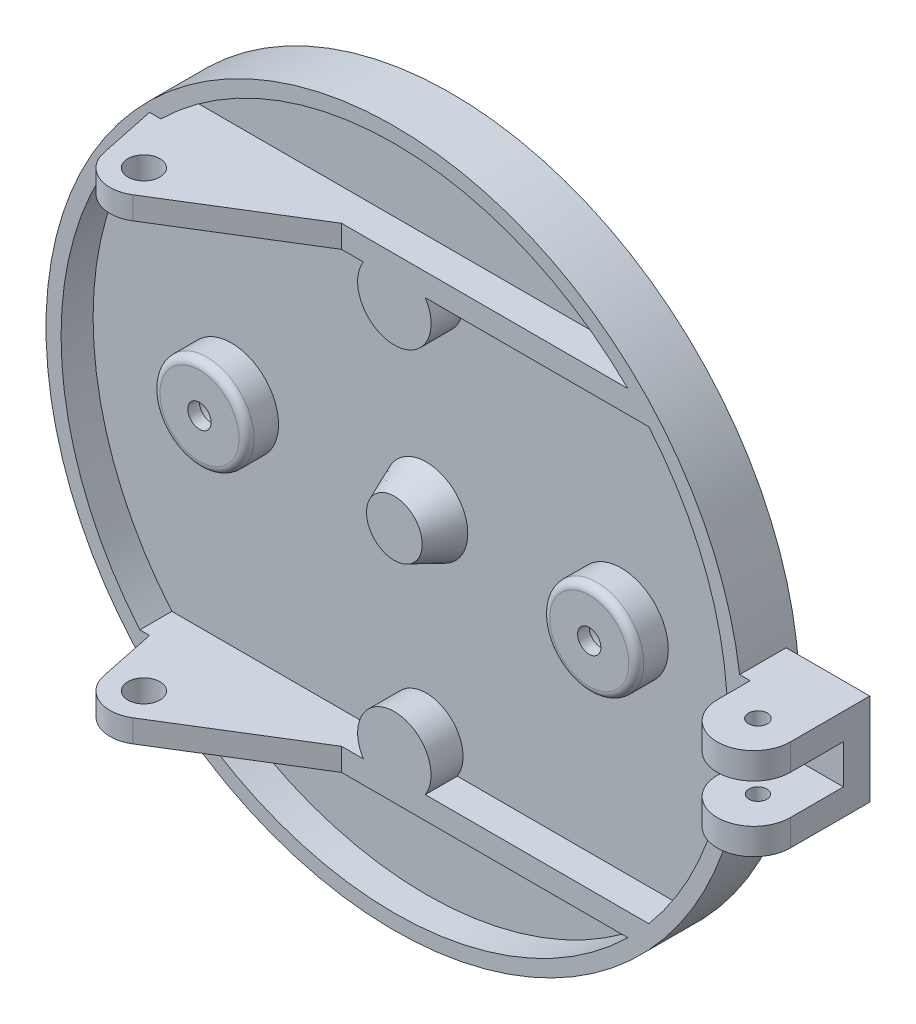
from build123d import *

# Parameters (mm, degrees)
ESQUISSE1_R                  = 92.5
BOSS_EXTRU_1_DEPTH           = 15.1
ESQUISSE2_R                  = 88.5
ENL_V_MAT_EXTRU_1_DEPTH      = 8.5
BOSS_EXTRU_2_DEPTH           = 8.5
ESQUISSE4_R                  = 11
BOSS_EXTRU_3_DEPTH           = 8.5
BOSS_EXTRU_3_TAPER           = 23
BOSS_EXTRU_4_DEPTH           = 12.2
ENL_V_MAT_EXTRU_2_REACH      = 230.654
ENL_V_MAT_EXTRU_2_END_RADIUS = 92.5
ESQUISSE6_W                  = 23.8
ESQUISSE6_H                  = 10.4
TROU_TARAUD_M61_D            = 5
TROU_TARAUD_M61_DEPTH        = 13
TROU_TARAUD_M61_TIP          = 1.502151548
ESQUISSE9_R                  = 2.375
ENL_V_MAT_EXTRU_3_DEPTH      = 154.76638937
ESQUISSE10_R                 = 4.25
BOSS_EXTRU_5_DEPTH           = 6
ESQUISSE11_R                 = 12.5
BOSS_EXTRU_6_DEPTH           = 8.5
CONG_1_R                     = 2
R_P_TITION_CIRCULAIRE1_COUNT = 2


with BuildPart() as part:
    # Esquisse1 → Boss.-Extru.1 (new body)
    with BuildSketch(Plane.XY):
        Circle(ESQUISSE1_R)
    extrude(amount=BOSS_EXTRU_1_DEPTH)

    # Esquisse2 → Enlèv. mat.-Extru.1 (cut)
    with BuildSketch(Plane.XY.offset(15.1)):
        Circle(ESQUISSE2_R)
    extrude(amount=-ENL_V_MAT_EXTRU_1_DEPTH, mode=Mode.SUBTRACT)

    # Esquisse3 → Boss.-Extru.2 (add)
    with BuildSketch(Plane.XY.offset(15.1)):
        with BuildLine():
            Line((-62.01282448, 63.14), (62.01282448, 63.14))
            ThreePointArc((62.01282448, 63.14), (64.86661415, 60.204421504), (67.58158329, 57.14))
            Line((67.58158329, 57.14), (8.215838363, 57.14))
            ThreePointArc((8.215838363, 57.14), (0, 42.14), (-8.215838363, 57.14))
            Line((-8.215838363, 57.14), (-67.58158329, 57.14))
            ThreePointArc((-67.58158329, 57.14), (-64.86661415, 60.204421504), (-62.01282448, 63.14))
        make_face()
        with BuildLine():
            Line((-67.58158329, -57.14), (-8.215838363, -57.14))
            ThreePointArc((-8.215838363, -57.14), (0, -42.14), (8.215838363, -57.14))
            Line((8.215838363, -57.14), (67.58158329, -57.14))
            ThreePointArc((67.58158329, -57.14), (64.86661415, -60.204421504), (62.01282448, -63.14))
            Line((62.01282448, -63.14), (-62.01282448, -63.14))
            ThreePointArc((-62.01282448, -63.14), (-64.86661415, -60.204421504), (-67.58158329, -57.14))
        make_face()
    extrude(amount=-BOSS_EXTRU_2_DEPTH)

    # Esquisse4 → Boss.-Extru.3 (add)
    with BuildSketch(Plane.XY.offset(6.6)):
        Circle(ESQUISSE4_R)
    extrude(amount=BOSS_EXTRU_3_DEPTH, taper=BOSS_EXTRU_3_TAPER)

    # Esquisse5 → Boss.-Extru.4 (add, symmetric)
    with BuildSketch(Plane(origin=(0, 0, 0), x_dir=(1, 0, 0), z_dir=(0, 1, 0))):
        with BuildLine():
            Line((90.5, -2.75), (113.9, -2.75))
            Line((113.9, -2.75), (113.9, -23.85))
            ThreePointArc((113.9, -23.85), (104.2, -33.55), (94.5, -23.85))
            Line((94.5, -23.85), (94.5, -15.1))
            Line((94.5, -15.1), (90.5, -15.1))
            Line((90.5, -15.1), (90.5, -2.75))
        make_face()
    extrude(amount=BOSS_EXTRU_4_DEPTH, both=True)

    # Enlèv. mat.-Extru.2: up to this cylinder (the profile starts outside it)
    enl_v_mat_extru_2_end = Plane(origin=(0, 0, 21.65), z_dir=(0, 0, -1)) * Cylinder(ENL_V_MAT_EXTRU_2_END_RADIUS, 647.308, mode=Mode.PRIVATE)
    # Esquisse6 → Enlèv. mat.-Extru.2 (cut, up to the surface)
    with BuildSketch(Plane(origin=(113.9, 0, 0), x_dir=(0, 0, -1), z_dir=(1, 0, 0)), mode=Mode.PRIVATE) as enl_v_mat_extru_2_sk1:
        with Locations((-21.65, 0)):
            Rectangle(ESQUISSE6_W, ESQUISSE6_H)
    enl_v_mat_extru_2_tool1 = extrude(enl_v_mat_extru_2_sk1.sketch, amount=-ENL_V_MAT_EXTRU_2_REACH, mode=Mode.PRIVATE) - enl_v_mat_extru_2_end
    add(enl_v_mat_extru_2_tool1.solids().sort_by_distance((113.9, 0, 21.65))[0], mode=Mode.SUBTRACT)

    # Trou taraudé M61
    with Locations(Plane(origin=(0, 12.2, 0), x_dir=(-1, 0, 0), z_dir=(0, 1, 0))):
        with Locations((-104.2, 22.75)):
            Hole(TROU_TARAUD_M61_D / 2, depth=TROU_TARAUD_M61_DEPTH)
            with Locations((0, 0, -(TROU_TARAUD_M61_DEPTH + TROU_TARAUD_M61_TIP / 2))):  # 118° drill point
                Cone(0, TROU_TARAUD_M61_D / 2, TROU_TARAUD_M61_TIP, mode=Mode.SUBTRACT)

    # Esquisse9 → Enlèv. mat.-Extru.3 (cut, through all)
    with BuildSketch(Plane(origin=(0, -5.2, 0), x_dir=(1, 0, 0), z_dir=(0, 1, 0))):
        with Locations(Location((104.2, -22.75, 0), (0, 0, 270))):
            Circle(ESQUISSE9_R)
    extrude(amount=-ENL_V_MAT_EXTRU_3_DEPTH, mode=Mode.SUBTRACT)

    # Esquisse10 → Boss.-Extru.5 (add)
    with BuildSketch(Plane(origin=(0, 63.14, 0), x_dir=(1, 0, 0), z_dir=(0, 1, 0))):
        with BuildLine():
            Line((-14, -15.1), (-48.272170546, -36.258173977))
            ThreePointArc((-48.272170546, -36.258173977), (-56.557229613, -36.867171069), (-61.811481567, -30.43242806))
            Line((-61.811481567, -30.43242806), (-65, -15.1))
            Line((-65, -15.1), (-14, -15.1))
        make_face()
        with Locations(Location((-53, -28.6, 0), (0, 0, 270))):
            Circle(ESQUISSE10_R, mode=Mode.SUBTRACT)
    boss_extru_5 = extrude(amount=-BOSS_EXTRU_5_DEPTH)

    # Symétrie1: Boss.-Extru.5 across plane
    add(boss_extru_5.mirror(Plane.ZX))

    # Esquisse11 → Boss.-Extru.6 (add)
    with BuildSketch(Plane.XY.offset(6.6)):
        with Locations((-51.75, 0)):
            Circle(ESQUISSE11_R)
        with Locations((51.75, 0)):
            Circle(ESQUISSE11_R)
    extrude(amount=BOSS_EXTRU_6_DEPTH)

    # Congé1
    cong_1_edges = [part.edges().sort_by_distance(p)[0] for p in [
        (-64.25, 0, 15.1),
        (39.25, 0, 15.1),
    ]]
    fillet(cong_1_edges, radius=CONG_1_R)

    # Esquisse12 → Enlèvement de matière-Révolution1 (revolve, cut)
    with BuildSketch(Plane(origin=(0, 0, 0), x_dir=(1, 0, 0), z_dir=(0, 1, 0)), mode=Mode.PRIVATE) as enl_vement_de_mati_re_r_volution1_sk:
        Polygon((57.9, 0), (57.9, -12), (54.85, -12), (54.85, -15.1), (51.75, -15.1), (51.75, 0), align=None)
    enl_vement_de_mati_re_r_volution1 = revolve(enl_vement_de_mati_re_r_volution1_sk.sketch.rotate(Axis((51.75, 0, -5.611731472), (0, 0, 1)), 180), axis=Axis((51.75, 0, -5.611731472), (0, 0, 1)), mode=Mode.SUBTRACT)

    # Répétition circulaire1: Enlèvement de matière-Révolution1 ×2 about axis
    r_p_tition_circulaire1_axis = Axis((0, 0, 0), (0, 0, 1))
    for i in range(1, R_P_TITION_CIRCULAIRE1_COUNT):
        add(enl_vement_de_mati_re_r_volution1.rotate(r_p_tition_circulaire1_axis, i * 360 / R_P_TITION_CIRCULAIRE1_COUNT), mode=Mode.SUBTRACT)


solid = part.part
